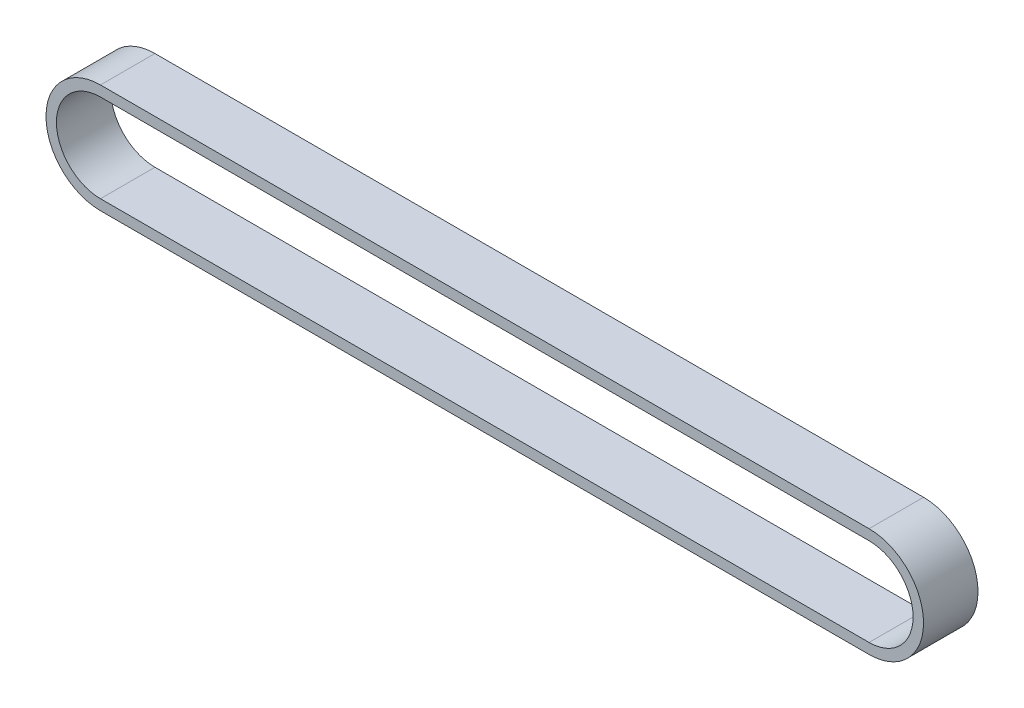
from build123d import *

# Parameters (mm, degrees)
BOSS_EXTRUDE1_DEPTH = 6


with BuildPart() as part:
    # Sketch1 → Boss-Extrude1 (new body)
    with BuildSketch(Plane.XY):
        with BuildLine():
            Line((-43.107769424, 19.533834586), (41.542230576, 19.533834586))
            ThreePointArc((41.542230576, 19.533834586), (47.542230576, 13.533834586), (41.542230576, 7.533834586))
            Line((41.542230576, 7.533834586), (-43.107769424, 7.533834586))
            ThreePointArc((-43.107769424, 7.533834586), (-49.107769424, 13.533834586), (-43.107769424, 19.533834586))
        make_face()
        with BuildLine():
            Line((-43.107769424, 18.383834586), (41.542230576, 18.383834586))
            ThreePointArc((41.542230576, 18.383834586), (46.392230576, 13.533834586), (41.542230576, 8.683834586))
            Line((41.542230576, 8.683834586), (-43.107769424, 8.683834586))
            ThreePointArc((-43.107769424, 8.683834586), (-47.957769424, 13.533834586), (-43.107769424, 18.383834586))
        make_face(mode=Mode.SUBTRACT)
    extrude(amount=BOSS_EXTRUDE1_DEPTH)


solid = part.part
